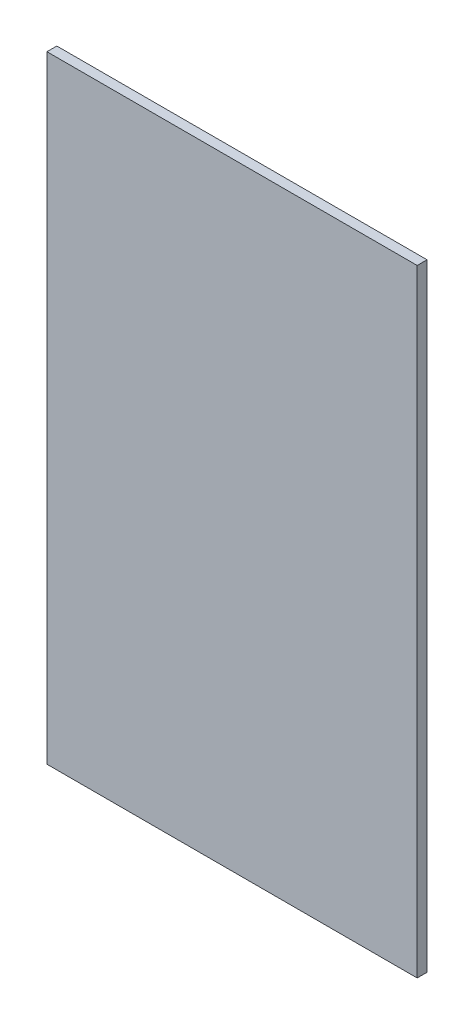
from build123d import *

# Parameters (mm, degrees)
SKETCH1_W           = 3
SKETCH1_H           = 5
BOSS_EXTRUDE1_DEPTH = 0.08


with BuildPart() as part:
    # Sketch1 → Boss-Extrude1 (new body)
    with BuildSketch(Plane.XY):
        Rectangle(SKETCH1_W, SKETCH1_H)
    extrude(amount=BOSS_EXTRUDE1_DEPTH)


solid = part.part
